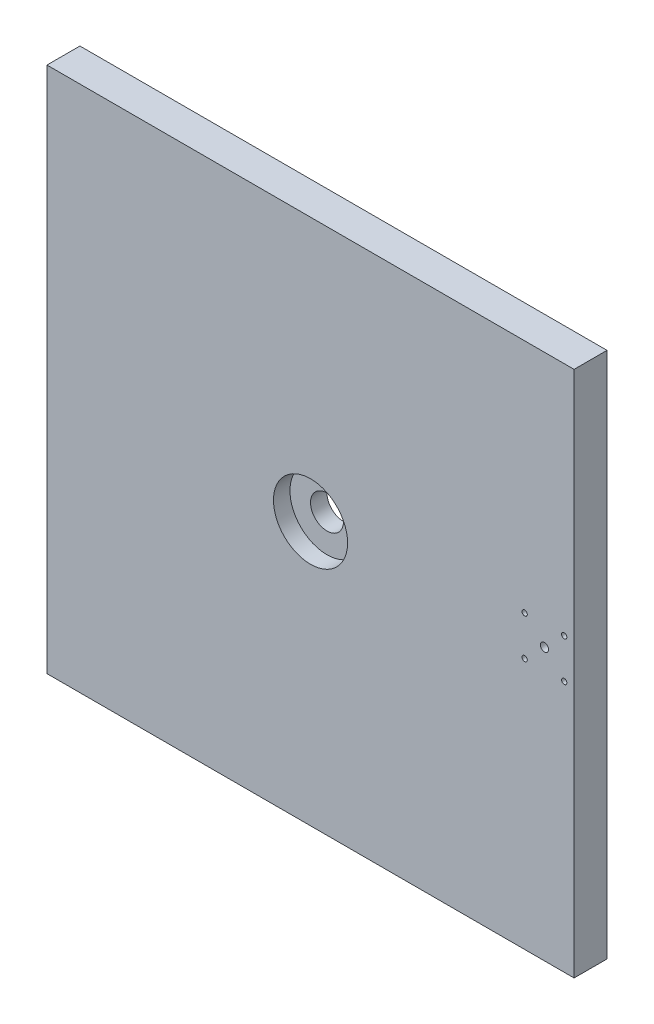
from build123d import *

# Parameters (mm, degrees)
SKETCH1_W                  = 203.2
SKETCH1_H                  = 203.2
BOSS_EXTRUDE1_DEPTH        = 12.7
F_1_2_0_5_DIAMETER_HOLE1_D = 12.7
SKETCH7_R                  = 14.2875
CUT_EXTRUDE1_DEPTH         = 6.35
SKETCH8_R                  = 1.5875
SKETCH8_R_2                = 1.016
CUT_EXTRUDE2_DEPTH         = 288.648691984


with BuildPart() as part:
    # Sketch1 → Boss-Extrude1 (new body)
    with BuildSketch(Plane.XY):
        with Locations((101.6, 101.6)):
            Rectangle(SKETCH1_W, SKETCH1_H)
    extrude(amount=BOSS_EXTRUDE1_DEPTH)

    # 1/2 (0.5) Diameter Hole1 (through all)
    with Locations(Plane.XY.offset(12.7)):
        with Locations((101.6, 101.6)):
            Hole(F_1_2_0_5_DIAMETER_HOLE1_D / 2)

    # Sketch7 → Cut-Extrude1 (cut)
    with BuildSketch(Plane.XY.offset(12.7)):
        with Locations((101.6, 101.6)):
            Circle(SKETCH7_R)
    extrude(amount=-CUT_EXTRUDE1_DEPTH, mode=Mode.SUBTRACT)

    # Sketch8 → Cut-Extrude2 (cut, through all)
    with BuildSketch(Plane.XY.offset(12.7)):
        with Locations((191.77, 104.729470927)):
            Circle(SKETCH8_R)
        with Locations((184.15, 112.349470927)):
            Circle(SKETCH8_R_2)
        with Locations((199.39, 112.349470927)):
            Circle(SKETCH8_R_2)
        with Locations((199.39, 97.109470927)):
            Circle(SKETCH8_R_2)
        with Locations((184.15, 97.109470927)):
            Circle(SKETCH8_R_2)
    extrude(amount=-CUT_EXTRUDE2_DEPTH, mode=Mode.SUBTRACT)


solid = part.part
